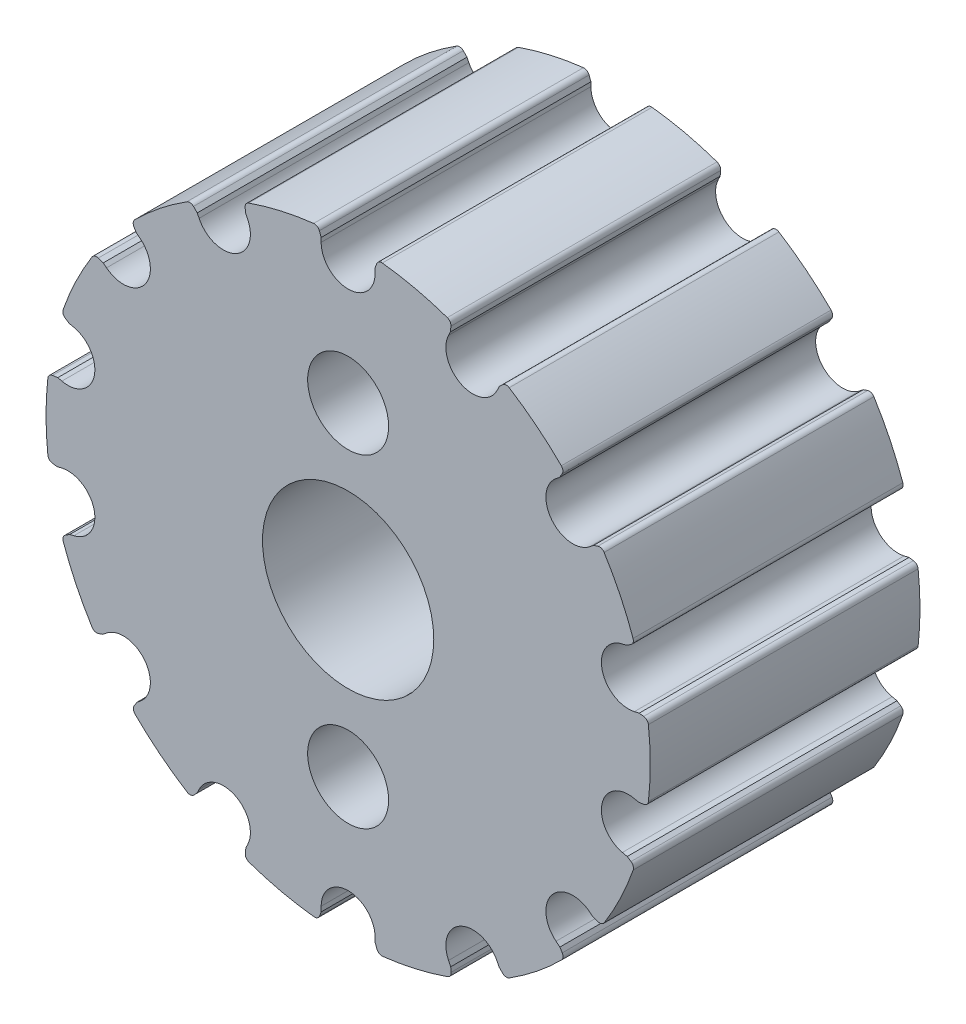
from build123d import *

# Parameters (mm, degrees)
SKETCH_1_R          = 2.5
SKETCH_1_R_2        = 1.5
EXTRUDE_1_DEPTH     = 10
FILLET_1_R          = 0.2
CUT_EXTRUDE_1_DEPTH = 10
SKETCH_3_R          = 3.175
CUT_EXTRUDE_2_DEPTH = 10


with BuildPart() as part:
    # Эскиз1 → Вытянуть1 (new body)
    with BuildSketch(Plane.XY):
        with BuildLine():
            Line((-0.685932761, 9.95), (0, 9.95))
            Line((0, 9.95), (0.676, 9.95))
            Line((0.676, 9.95), (1.110862137, 11.144773901))
            ThreePointArc((1.110862137, 11.144773901), (2.487539236, 10.920263209), (3.825633205, 10.526373097))
            Line((3.825633205, 10.526373097), (3.699139141, 9.262255307))
            Line((3.699139141, 9.262255307), (4.317143204, 8.964640236))
            Line((4.317143204, 8.964640236), (4.926198159, 8.671334828))
            Line((4.926198159, 8.671334828), (5.836388374, 9.559109307))
            ThreePointArc((5.836388374, 9.559109307), (6.979320043, 8.759514355), (8.013998536, 7.824054413))
            Line((8.013998536, 7.824054413), (7.351551169, 6.740007356))
            Line((7.351551169, 6.740007356), (7.779223251, 6.203723528))
            Line((7.779223251, 6.203723528), (8.200702357, 5.675205446))
            Line((8.200702357, 5.675205446), (9.405946315, 6.08014588))
            ThreePointArc((9.405946315, 6.08014588), (10.088760919, 4.863836255), (10.615093172, 3.572085797))
            Line((10.615093172, 3.572085797), (9.547898328, 2.882818288))
            Line((9.547898328, 2.882818288), (9.700532726, 2.214083293))
            Line((9.700532726, 2.214083293), (9.850956878, 1.555032024))
            Line((9.850956878, 1.555032024), (11.112541232, 1.396934994))
            ThreePointArc((11.112541232, 1.396934994), (11.199998965, 0.004815734), (11.11373842, -1.38737822))
            Line((11.11373842, -1.38737822), (9.853167125, -1.545348298))
            Line((9.853167125, -1.545348298), (9.700532726, -2.214083293))
            Line((9.700532726, -2.214083293), (9.550108575, -2.873134562))
            Line((9.550108575, -2.873134562), (10.618161071, -3.562956001))
            ThreePointArc((10.618161071, -3.562956001), (10.092939856, -4.855158602), (9.411171473, -6.072054966))
            Line((9.411171473, -6.072054966), (8.206895332, -5.667439701))
            Line((8.206895332, -5.667439701), (7.779223251, -6.203723528))
            Line((7.779223251, -6.203723528), (7.357744145, -6.732241611))
            Line((7.357744145, -6.732241611), (8.020723888, -7.817159863))
            ThreePointArc((8.020723888, -7.817159863), (6.986850228, -8.753509233), (5.844606595, -9.554086756))
            Line((5.844606595, -9.554086756), (4.935147268, -8.667025164))
            Line((4.935147268, -8.667025164), (4.317143204, -8.964640236))
            Line((4.317143204, -8.964640236), (3.70808825, -9.257945643))
            Line((3.70808825, -9.257945643), (3.83468397, -10.523079343))
            ThreePointArc((3.83468397, -10.523079343), (2.496929223, -10.918120005), (1.120445701, -11.143814492))
            Line((1.120445701, -11.143814492), (0.685932761, -9.95))
            Line((0.685932761, -9.95), (0, -9.95))
            Line((0, -9.95), (-0.676, -9.95))
            Line((-0.676, -9.95), (-1.110862137, -11.144773901))
            ThreePointArc((-1.110862137, -11.144773901), (-2.487539236, -10.920263209), (-3.825633205, -10.526373097))
            Line((-3.825633205, -10.526373097), (-3.699139141, -9.262255307))
            Line((-3.699139141, -9.262255307), (-4.317143204, -8.964640236))
            Line((-4.317143204, -8.964640236), (-4.926198159, -8.671334828))
            Line((-4.926198159, -8.671334828), (-5.836388374, -9.559109307))
            ThreePointArc((-5.836388374, -9.559109307), (-6.979320043, -8.759514355), (-8.013998536, -7.824054413))
            Line((-8.013998536, -7.824054413), (-7.351551169, -6.740007356))
            Line((-7.351551169, -6.740007356), (-7.779223251, -6.203723528))
            Line((-7.779223251, -6.203723528), (-8.200702357, -5.675205446))
            Line((-8.200702357, -5.675205446), (-9.405946315, -6.08014588))
            ThreePointArc((-9.405946315, -6.08014588), (-10.088760919, -4.863836255), (-10.615093172, -3.572085797))
            Line((-10.615093172, -3.572085797), (-9.547898328, -2.882818288))
            Line((-9.547898328, -2.882818288), (-9.700532726, -2.214083293))
            Line((-9.700532726, -2.214083293), (-9.850956878, -1.555032024))
            Line((-9.850956878, -1.555032024), (-11.112541232, -1.396934994))
            ThreePointArc((-11.112541232, -1.396934994), (-11.199998965, -0.004815734), (-11.11373842, 1.38737822))
            Line((-11.11373842, 1.38737822), (-9.853167125, 1.545348298))
            Line((-9.853167125, 1.545348298), (-9.700532726, 2.214083293))
            Line((-9.700532726, 2.214083293), (-9.550108575, 2.873134562))
            Line((-9.550108575, 2.873134562), (-10.618161071, 3.562956001))
            ThreePointArc((-10.618161071, 3.562956001), (-10.092939856, 4.855158602), (-9.411171473, 6.072054966))
            Line((-9.411171473, 6.072054966), (-8.206895332, 5.667439701))
            Line((-8.206895332, 5.667439701), (-7.779223251, 6.203723528))
            Line((-7.779223251, 6.203723528), (-7.357744145, 6.732241611))
            Line((-7.357744145, 6.732241611), (-8.020723888, 7.817159863))
            ThreePointArc((-8.020723888, 7.817159863), (-6.986850228, 8.753509233), (-5.844606595, 9.554086756))
            Line((-5.844606595, 9.554086756), (-4.935147268, 8.667025164))
            Line((-4.935147268, 8.667025164), (-4.317143204, 8.964640236))
            Line((-4.317143204, 8.964640236), (-3.70808825, 9.257945643))
            Line((-3.70808825, 9.257945643), (-3.83468397, 10.523079343))
            ThreePointArc((-3.83468397, 10.523079343), (-2.496929223, 10.918120005), (-1.120445701, 11.143814492))
            Line((-1.120445701, 11.143814492), (-0.685932761, 9.95))
        make_face()
        Circle(SKETCH_1_R, mode=Mode.SUBTRACT)
        with Locations((0, 6)):
            Circle(SKETCH_1_R_2, mode=Mode.SUBTRACT)
        with Locations((0, -6)):
            Circle(SKETCH_1_R_2, mode=Mode.SUBTRACT)
    extrude(amount=EXTRUDE_1_DEPTH)

    # Скругление1
    fillet_1_edges = [part.edges().sort_by_distance(p)[0] for p in [
        (9.547898328, 2.882818288, 5),
        (9.850956878, 1.555032024, 5),
        (11.112541232, 1.396934994, 5),
        (11.11373842, -1.38737822, 5),
        (9.853167125, -1.545348298, 5),
        (9.550108575, -2.873134562, 5),
        (10.618161071, -3.562956001, 5),
        (9.411171473, -6.072054966, 5),
        (8.206895332, -5.667439701, 5),
        (7.357744145, -6.732241611, 5),
        (8.020723888, -7.817159863, 5),
        (5.844606595, -9.554086756, 5),
        (4.935147268, -8.667025164, 5),
        (3.70808825, -9.257945643, 5),
        (3.83468397, -10.523079343, 5),
        (1.120445701, -11.143814492, 5),
        (0.685932761, -9.95, 5),
        (-0.676, -9.95, 5),
        (-1.110862137, -11.144773901, 5),
        (-3.825633205, -10.526373097, 5),
        (-3.699139141, -9.262255307, 5),
        (-4.926198159, -8.671334828, 5),
        (-5.836388374, -9.559109307, 5),
        (-8.013998536, -7.824054413, 5),
        (-7.351551169, -6.740007356, 5),
        (-8.200702357, -5.675205446, 5),
        (-9.405946315, -6.08014588, 5),
        (-10.615093172, -3.572085797, 5),
        (-9.547898328, -2.882818288, 5),
        (-9.850956878, -1.555032024, 5),
        (-11.112541232, -1.396934994, 5),
        (-11.11373842, 1.38737822, 5),
        (-9.853167125, 1.545348298, 5),
        (-10.618161071, 3.562956001, 5),
        (-9.411171473, 6.072054966, 5),
        (-8.206895332, 5.667439701, 5),
        (-7.357744145, 6.732241611, 5),
        (-8.020723888, 7.817159863, 5),
        (-5.844606595, 9.554086756, 5),
        (-4.935147268, 8.667025164, 5),
        (-3.70808825, 9.257945643, 5),
        (-3.83468397, 10.523079343, 5),
        (-1.120445701, 11.143814492, 5),
        (-0.685932761, 9.95, 5),
        (0.676, 9.95, 5),
        (1.110862137, 11.144773901, 5),
        (3.825633205, 10.526373097, 5),
        (3.699139141, 9.262255307, 5),
        (4.926198159, 8.671334828, 5),
        (5.836388374, 9.559109307, 5),
        (8.013998536, 7.824054413, 5),
        (7.351551169, 6.740007356, 5),
        (8.200702357, 5.675205446, 5),
        (9.405946315, 6.08014588, 5),
        (10.615093172, 3.572085797, 5),
    ]]
    fillet(fillet_1_edges, radius=FILLET_1_R)

    # Эскиз2 → Вырез-Вытянуть1 (cut)
    with BuildSketch(Plane.XY.offset(10)):
        with BuildLine():
            Line((4.740104239, 12.147692744), (6.542041974, 11.279925266))
            Line((6.542041974, 11.279925266), (5.524607217, 9.167200224))
            ThreePointArc((5.524607217, 9.167200224), (4.18975461, 8.700115095), (3.722669482, 10.034967702))
            Line((3.722669482, 10.034967702), (4.740104239, 12.147692744))
        make_face()
        with BuildLine():
            Line((-1, 13.00134713), (1, 13.00134713))
            Line((1, 13.00134713), (1, 10.656399244))
            ThreePointArc((1, 10.656399244), (0, 9.656399244), (-1, 10.656399244))
            Line((-1, 10.656399244), (-1, 13.00134713))
        make_face()
        with BuildLine():
            Line((9.541372699, 8.888038829), (10.788352303, 7.324375864))
            Line((10.788352303, 7.324375864), (8.95499822, 5.862324771))
            ThreePointArc((8.95499822, 5.862324771), (7.549676936, 6.020666451), (7.708018617, 7.425987736))
            Line((7.708018617, 7.425987736), (9.541372699, 8.888038829))
        make_face()
        with BuildLine():
            Line((12.45285528, 3.867999818), (12.897897147, 1.918143994))
            Line((12.897897147, 1.918143994), (10.611742, 1.396344))
            ThreePointArc((10.611742, 1.396344), (9.414293154, 2.148750978), (10.166700132, 3.346199825))
            Line((10.166700132, 3.346199825), (12.45285528, 3.867999818))
        make_face()
        with BuildLine():
            Line((12.897897147, -1.918143994), (12.45285528, -3.867999818))
            Line((12.45285528, -3.867999818), (10.166700132, -3.346199825))
            ThreePointArc((10.166700132, -3.346199825), (9.414293154, -2.148750978), (10.611742, -1.396344))
            Line((10.611742, -1.396344), (12.897897147, -1.918143994))
        make_face()
        with BuildLine():
            Line((10.788352303, -7.324375864), (9.541372699, -8.888038829))
            Line((9.541372699, -8.888038829), (7.708018617, -7.425987736))
            ThreePointArc((7.708018617, -7.425987736), (7.549676936, -6.020666451), (8.95499822, -5.862324771))
            Line((8.95499822, -5.862324771), (10.788352303, -7.324375864))
        make_face()
        with BuildLine():
            Line((6.542041974, -11.279925266), (4.740104239, -12.147692744))
            Line((4.740104239, -12.147692744), (3.722669482, -10.034967702))
            ThreePointArc((3.722669482, -10.034967702), (4.18975461, -8.700115095), (5.524607217, -9.167200224))
            Line((5.524607217, -9.167200224), (6.542041974, -11.279925266))
        make_face()
        with BuildLine():
            Line((1, -13.00134713), (-1, -13.00134713))
            Line((-1, -13.00134713), (-1, -10.656399244))
            ThreePointArc((-1, -10.656399244), (0, -9.656399244), (1, -10.656399244))
            Line((1, -10.656399244), (1, -13.00134713))
        make_face()
        with BuildLine():
            Line((-4.740104239, -12.147692744), (-6.542041974, -11.279925266))
            Line((-6.542041974, -11.279925266), (-5.524607217, -9.167200224))
            ThreePointArc((-5.524607217, -9.167200224), (-4.18975461, -8.700115095), (-3.722669482, -10.034967702))
            Line((-3.722669482, -10.034967702), (-4.740104239, -12.147692744))
        make_face()
        with BuildLine():
            Line((-9.541372699, -8.888038829), (-10.788352303, -7.324375864))
            Line((-10.788352303, -7.324375864), (-8.95499822, -5.862324771))
            ThreePointArc((-8.95499822, -5.862324771), (-7.549676936, -6.020666451), (-7.708018617, -7.425987736))
            Line((-7.708018617, -7.425987736), (-9.541372699, -8.888038829))
        make_face()
        with BuildLine():
            Line((-12.452855279, -3.867999818), (-12.897897147, -1.918143994))
            Line((-12.897897147, -1.918143994), (-10.611742, -1.396344))
            ThreePointArc((-10.611742, -1.396344), (-9.414293154, -2.148750978), (-10.166700132, -3.346199825))
            Line((-10.166700132, -3.346199825), (-12.452855279, -3.867999818))
        make_face()
        with BuildLine():
            Line((-12.897897147, 1.918143994), (-12.45285528, 3.867999818))
            Line((-12.45285528, 3.867999818), (-10.166700132, 3.346199825))
            ThreePointArc((-10.166700132, 3.346199825), (-9.414293154, 2.148750978), (-10.611742, 1.396344))
            Line((-10.611742, 1.396344), (-12.897897147, 1.918143994))
        make_face()
        with BuildLine():
            Line((-10.788352303, 7.324375864), (-9.541372699, 8.888038829))
            Line((-9.541372699, 8.888038829), (-7.708018617, 7.425987736))
            ThreePointArc((-7.708018617, 7.425987736), (-7.549676936, 6.020666451), (-8.95499822, 5.862324771))
            Line((-8.95499822, 5.862324771), (-10.788352303, 7.324375864))
        make_face()
        with BuildLine():
            Line((-6.542041974, 11.279925266), (-4.740104239, 12.147692744))
            Line((-4.740104239, 12.147692744), (-3.722669482, 10.034967702))
            ThreePointArc((-3.722669482, 10.034967702), (-4.18975461, 8.700115095), (-5.524607217, 9.167200224))
            Line((-5.524607217, 9.167200224), (-6.542041974, 11.279925266))
        make_face()
    extrude(amount=-CUT_EXTRUDE_1_DEPTH, mode=Mode.SUBTRACT)

    # Эскиз3 → Вырез-Вытянуть2 (cut)
    with BuildSketch(Plane.XY.offset(10)):
        Circle(SKETCH_3_R)
    extrude(amount=-CUT_EXTRUDE_2_DEPTH, mode=Mode.SUBTRACT)


solid = part.part
